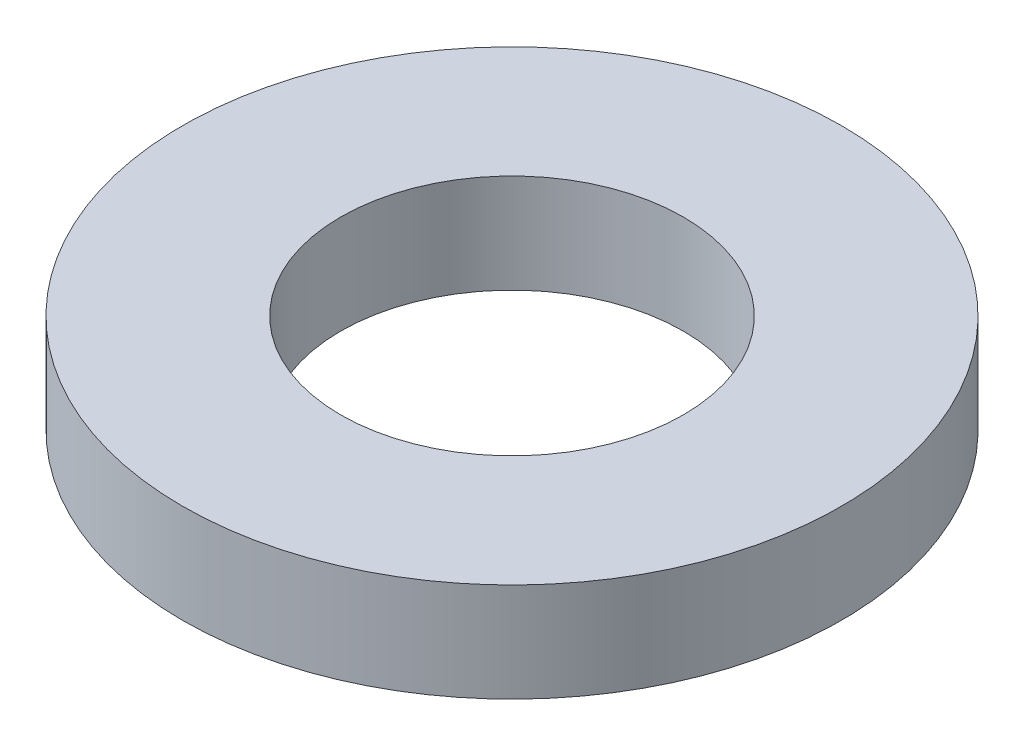
from build123d import *

# Parameters (mm, degrees)
SKETCH_1_R      = 5
SKETCH_1_R_2    = 2.6
EXTRUDE_1_DEPTH = 1.5


with BuildPart() as part:
    # 草图1 → 凸台-拉伸1 (new body)
    with BuildSketch(Plane(origin=(0, 0, 0), x_dir=(1, 0, 0), z_dir=(0, 1, 0))):
        with Locations(Location((0, 0, 0), (0, 0, 270))):
            Circle(SKETCH_1_R)
        with Locations(Location((0, 0, 0), (0, 0, 270))):
            Circle(SKETCH_1_R_2, mode=Mode.SUBTRACT)
    extrude(amount=EXTRUDE_1_DEPTH)


solid = part.part
